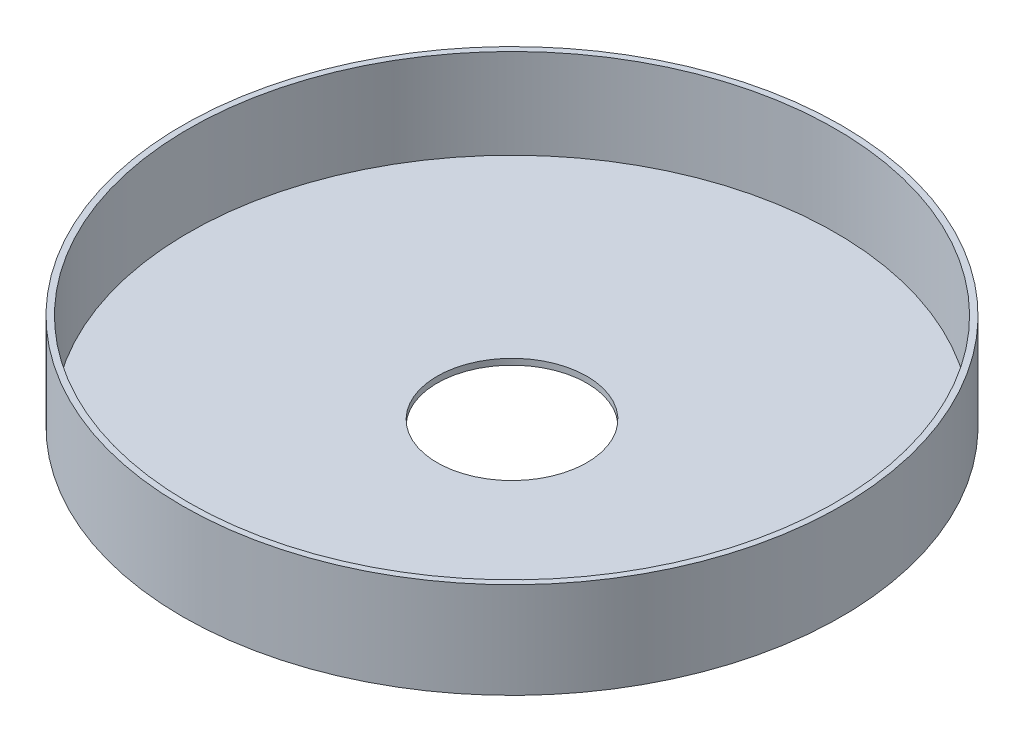
from build123d import *

# Parameters (mm, degrees)
SKETCH1_R           = 55
SKETCH1_R_2         = 54
BOSS_EXTRUDE1_DEPTH = 15
BOSS_EXTRUDE2_START = 1
SKETCH2_R           = 55
SKETCH2_R_2         = 12.5
BOSS_EXTRUDE2_DEPTH = 1


with BuildPart() as part:
    # Sketch1 → Boss-Extrude1 (new body)
    with BuildSketch(Plane(origin=(0, 0, 0), x_dir=(1, 0, 0), z_dir=(0, 1, 0))):
        with Locations(Location((0, 0, 0), (0, 0, 270))):
            Circle(SKETCH1_R)
        with Locations(Location((0, 0, 0), (0, 0, 270))):
            Circle(SKETCH1_R_2, mode=Mode.SUBTRACT)
    extrude(amount=BOSS_EXTRUDE1_DEPTH)

    # Sketch2 → Boss-Extrude2 (add)
    with BuildSketch(Plane.XZ.offset(BOSS_EXTRUDE2_START)):
        with Locations(Location((0, 0, 0), (0, 0, 270))):
            Circle(SKETCH2_R)
        with Locations(Location((0, 0, 0), (0, 0, 270))):
            Circle(SKETCH2_R_2, mode=Mode.SUBTRACT)
    extrude(amount=-BOSS_EXTRUDE2_DEPTH)


solid = part.part
